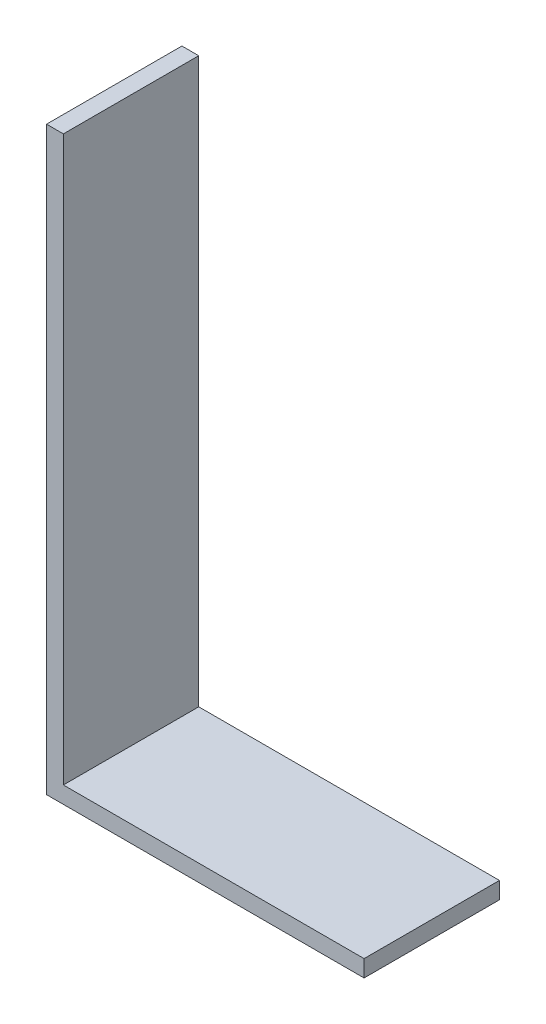
from build123d import *

# Parameters (mm, degrees)
SALIENTE_EXTRUIR1_DEPTH = 50.8


with BuildPart() as part:
    # Croquis1 → Saliente-Extruir1 (new body)
    with BuildSketch(Plane.XY):
        Polygon((119.155, 6.31), (119.155, 0), (0, 0), (0, 217.90628726), (6.31, 217.90628726), (6.31, 6.31), align=None)
    extrude(amount=SALIENTE_EXTRUIR1_DEPTH)


solid = part.part
